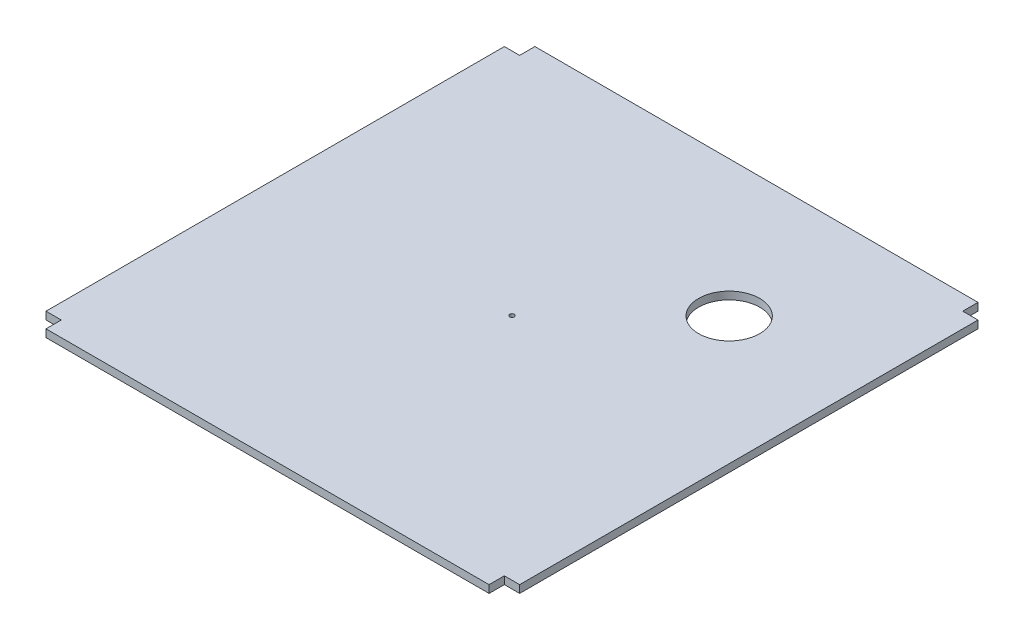
from build123d import *

# Parameters (mm, degrees)
SKETCH_1_W          = 310
SKETCH_1_H          = 320
EXTRUDE_1_DEPTH     = 5
SKETCH_4_R          = 1.5
SKETCH_4_R_2        = 20
SKETCH_4_W          = 10
SKETCH_4_H          = 10
CUT_EXTRUDE_2_DEPTH = 5


with BuildPart() as part:
    # 草图1 → 凸台-拉伸1 (new body)
    with BuildSketch(Plane(origin=(0, 0, 0), x_dir=(1, 0, 0), z_dir=(0, 1, 0))):
        Rectangle(SKETCH_1_W, SKETCH_1_H)
    extrude(amount=EXTRUDE_1_DEPTH)

    # 草图4 → 切除-拉伸2 (cut)
    with BuildSketch(Plane(origin=(0, 5, 0), x_dir=(1, 0, 0), z_dir=(0, 1, 0))):
        with Locations(Location((0, 0, 0), (0, 0, 270))):
            Circle(SKETCH_4_R)
        with Locations(Location((71.315589165, 70.826615801, 0), (0, 0, 270))):
            Circle(SKETCH_4_R_2)
        with Locations((-150, 155)):
            Rectangle(SKETCH_4_W, SKETCH_4_H)
        with Locations((-150, -155)):
            Rectangle(SKETCH_4_W, SKETCH_4_H)
        with Locations((150, -155)):
            Rectangle(SKETCH_4_W, SKETCH_4_H)
        with Locations((150, 155)):
            Rectangle(SKETCH_4_W, SKETCH_4_H)
    extrude(amount=-CUT_EXTRUDE_2_DEPTH, mode=Mode.SUBTRACT)


solid = part.part
